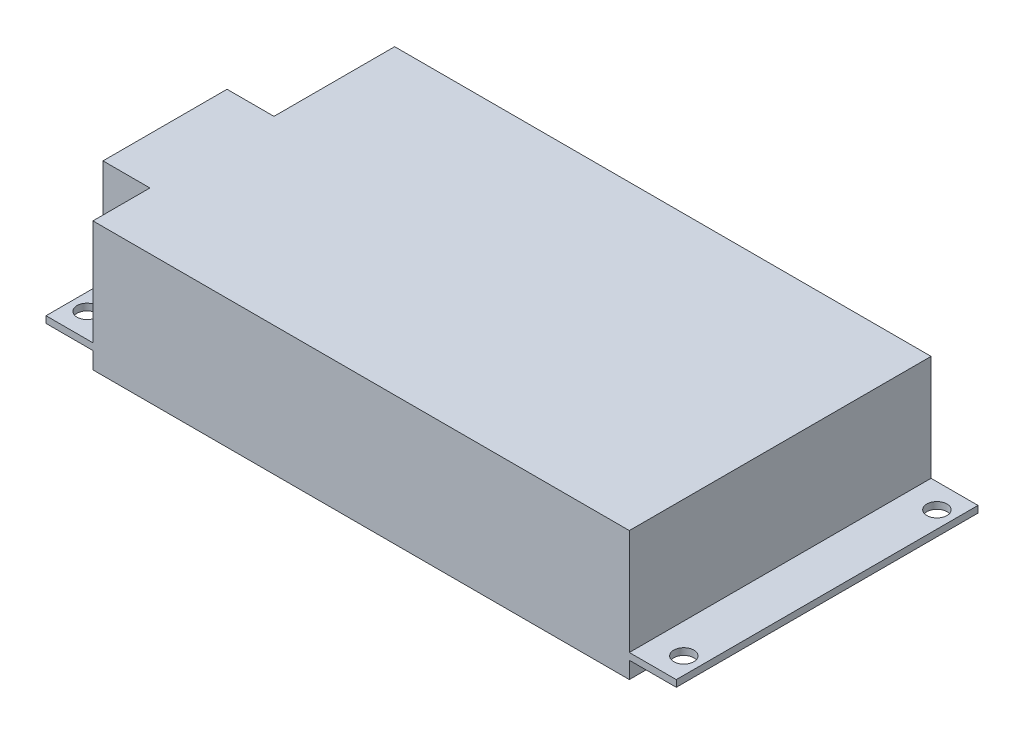
from build123d import *

# Parameters (mm, degrees)
SKETCH1_W                = 188
SKETCH1_H                = 90
SKETCH1_R                = 3
BOSS_EXTRUDE1_DEPTH      = 2
BOSS_EXTRUDE2_DEPTH      = 31.5
BOSS_EXTRUDE2_DEPTH_BACK = 7
SKETCH2_W                = 14
SKETCH2_H                = 37


with BuildPart() as part:
    # Sketch1 → Boss-Extrude1 (new body)
    with BuildSketch(Plane(origin=(0, 0, 0), x_dir=(1, 0, 0), z_dir=(0, 1, 0))):
        Rectangle(SKETCH1_W, SKETCH1_H)
        with Locations(Location((-89, 37.75, 0), (0, 0, 270))):
            Circle(SKETCH1_R, mode=Mode.SUBTRACT)
        with Locations(Location((89, 37.75, 0), (0, 0, 270))):
            Circle(SKETCH1_R, mode=Mode.SUBTRACT)
        with Locations(Location((89, -37.75, 0), (0, 0, 270))):
            Circle(SKETCH1_R, mode=Mode.SUBTRACT)
        with Locations(Location((-89, -37.75, 0), (0, 0, 270))):
            Circle(SKETCH1_R, mode=Mode.SUBTRACT)
    extrude(amount=BOSS_EXTRUDE1_DEPTH)

    # Sketch2 → Boss-Extrude2 (add, two sides: drawn at the far end of the back side and taken through both)
    with BuildSketch(Plane(origin=(0, 2, 0), x_dir=(1, 0, 0), z_dir=(0, 1, 0)).offset(-BOSS_EXTRUDE2_DEPTH_BACK)):
        Polygon((-80, -28), (-80, -45), (80, -45), (80, 45), (-80, 45), (-80, 9), align=None)
        with Locations((-87, -9.5)):
            Rectangle(SKETCH2_W, SKETCH2_H)
    extrude(amount=BOSS_EXTRUDE2_DEPTH + BOSS_EXTRUDE2_DEPTH_BACK)


solid = part.part
